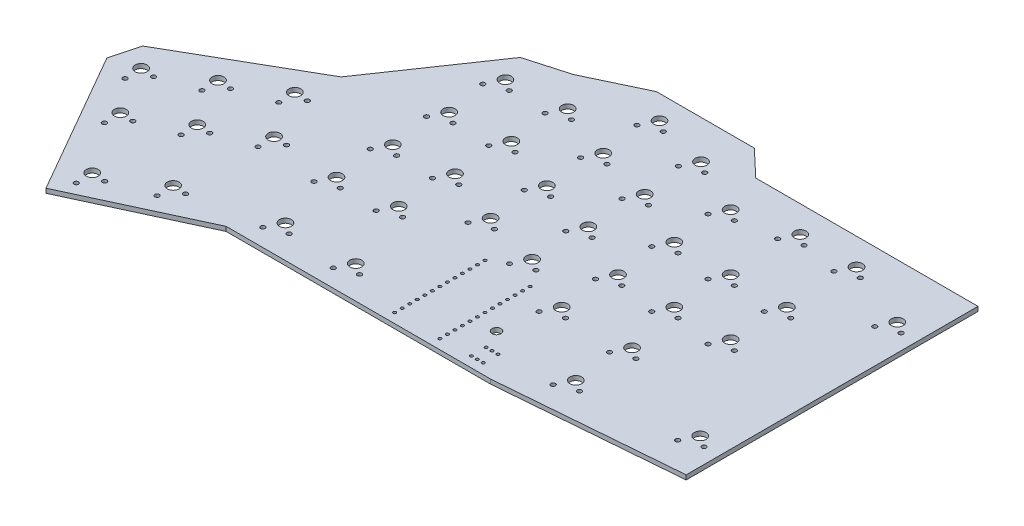
from build123d import *

# Parameters (mm, degrees)
BOSS_EXTRUDE1_DEPTH = 1.5
SKETCH3_R           = 2
CUT_EXTRUDE1_DEPTH  = 185.595537716
SKETCH4_R           = 0.75
CUT_EXTRUDE2_DEPTH  = 185.595537716
SKETCH5_R           = 0.5
SKETCH5_R_2         = 1.5
CUT_EXTRUDE3_DEPTH  = 185.595537716
SKETCH6_R           = 0.5
CUT_EXTRUDE4_DEPTH  = 185.595537716


with BuildPart() as part:
    # Sketch2 → Boss-Extrude1 (new body)
    with BuildSketch(Plane(origin=(0, 0, 0), x_dir=(1, 0, 0), z_dir=(0, 1, 0))):
        Polygon((71, 31), (38, 31), (19, 22), (5, 18), (-19.539258734, -17.929094976), (-62.018836039, -42.352147857), (-64.598339528, -51.909666455), (-36.810886505, -100.241022266), (4.75, -81), (94, -81), (155, -76), (155, 22.5), (80, 22.5), align=None)
    extrude(amount=-BOSS_EXTRUDE1_DEPTH)

    # Sketch3 → Cut-Extrude1 (cut, through all)
    with BuildSketch(Plane(origin=(0, 0, 0), x_dir=(1, 0, 0), z_dir=(0, 1, 0))):
        with Locations(Location((-55.799108885, -49.157659897, 0), (0, 0, 270))):
            Circle(SKETCH3_R)
        with Locations(Location((-39.327436053, -39.687496535, 0), (0, 0, 270))):
            Circle(SKETCH3_R)
        with Locations(Location((-22.85576322, -30.217333173, 0), (0, 0, 270))):
            Circle(SKETCH3_R)
        with Locations(Location((-46.328945523, -65.62933273, 0), (0, 0, 270))):
            Circle(SKETCH3_R)
        with Locations(Location((-29.857272691, -56.159169368, 0), (0, 0, 270))):
            Circle(SKETCH3_R)
        with Locations(Location((-13.385599858, -46.689006006, 0), (0, 0, 270))):
            Circle(SKETCH3_R)
        with Locations(Location((-33.494382019, -87.952784068, 0), (0, 0, 270))):
            Circle(SKETCH3_R)
        with Locations(Location((-16.155779038, -77.984191056, 0), (0, 0, 270))):
            Circle(SKETCH3_R)
        with Locations(Location((13.75, -70, 0), (0, 0, 270))):
            Circle(SKETCH3_R)
        with Locations(Location((37.5, -70, 0), (0, 0, 270))):
            Circle(SKETCH3_R)
        with Locations(Location((28, -46, 0), (0, 0, 270))):
            Circle(SKETCH3_R)
        with Locations(Location((9, -48, 0), (0, 0, 270))):
            Circle(SKETCH3_R)
        with Locations(Location((9, -29, 0), (0, 0, 270))):
            Circle(SKETCH3_R)
        with Locations(Location((28, -27, 0), (0, 0, 270))):
            Circle(SKETCH3_R)
        with Locations(Location((47, -34, 0), (0, 0, 270))):
            Circle(SKETCH3_R)
        with Locations(Location((66, -39, 0), (0, 0, 270))):
            Circle(SKETCH3_R)
        with Locations(Location((9, -10, 0), (0, 0, 270))):
            Circle(SKETCH3_R)
        with Locations(Location((9, 9, 0), (0, 0, 270))):
            Circle(SKETCH3_R)
        with Locations(Location((28, 11, 0), (0, 0, 270))):
            Circle(SKETCH3_R)
        with Locations(Location((47, 23, 0), (0, 0, 270))):
            Circle(SKETCH3_R)
        with Locations(Location((47, 4, 0), (0, 0, 270))):
            Circle(SKETCH3_R)
        with Locations(Location((28, -8, 0), (0, 0, 270))):
            Circle(SKETCH3_R)
        with Locations(Location((47, -15, 0), (0, 0, 270))):
            Circle(SKETCH3_R)
        with Locations(Location((66, 18, 0), (0, 0, 270))):
            Circle(SKETCH3_R)
        with Locations(Location((66, -1, 0), (0, 0, 270))):
            Circle(SKETCH3_R)
        with Locations(Location((66, -20, 0), (0, 0, 270))):
            Circle(SKETCH3_R)
        with Locations(Location((85, 9, 0), (0, 0, 270))):
            Circle(SKETCH3_R)
        with Locations(Location((104, 13.5, 0), (0, 0, 270))):
            Circle(SKETCH3_R)
        with Locations(Location((123, 13.5, 0), (0, 0, 270))):
            Circle(SKETCH3_R)
        with Locations(Location((146, 4.25, 0), (0, 0, 270))):
            Circle(SKETCH3_R)
        with Locations(Location((123, -10, 0), (0, 0, 270))):
            Circle(SKETCH3_R)
        with Locations(Location((104, -10, 0), (0, 0, 270))):
            Circle(SKETCH3_R)
        with Locations(Location((85, -10, 0), (0, 0, 270))):
            Circle(SKETCH3_R)
        with Locations(Location((85, -29, 0), (0, 0, 270))):
            Circle(SKETCH3_R)
        with Locations(Location((104, -29, 0), (0, 0, 270))):
            Circle(SKETCH3_R)
        with Locations(Location((123, -29, 0), (0, 0, 270))):
            Circle(SKETCH3_R)
        with Locations(Location((85, -48, 0), (0, 0, 270))):
            Circle(SKETCH3_R)
        with Locations(Location((108.75, -48, 0), (0, 0, 270))):
            Circle(SKETCH3_R)
        with Locations(Location((108.75, -67, 0), (0, 0, 270))):
            Circle(SKETCH3_R)
        with Locations(Location((146, -62.25, 0), (0, 0, 270))):
            Circle(SKETCH3_R)
    extrude(amount=-CUT_EXTRUDE1_DEPTH, mode=Mode.SUBTRACT)

    # Sketch4 → Cut-Extrude2 (cut, through all)
    with BuildSketch(Plane(origin=(0, 0, 0), x_dir=(1, 0, 0), z_dir=(0, 1, 0))):
        with Locations(Location((-55.540504123, -54.831382095, 0), (0, 0, 270))):
            Circle(SKETCH4_R)
        with Locations(Location((-51.234270651, -49.518148307, 0), (0, 0, 270))):
            Circle(SKETCH4_R)
        with Locations(Location((-39.068831291, -45.361218733, 0), (0, 0, 270))):
            Circle(SKETCH4_R)
        with Locations(Location((-34.762597818, -40.047984945, 0), (0, 0, 270))):
            Circle(SKETCH4_R)
        with Locations(Location((-22.597158458, -35.891055371, 0), (0, 0, 270))):
            Circle(SKETCH4_R)
        with Locations(Location((-18.290924986, -30.577821583, 0), (0, 0, 270))):
            Circle(SKETCH4_R)
        with Locations(Location((25.46, -51.08, 0), (0, 0, 270))):
            Circle(SKETCH4_R)
        with Locations(Location((149.81, 1.71, 0), (0, 0, 270))):
            Circle(SKETCH4_R)
        with Locations(Location((143.46, -0.83, 0), (0, 0, 270))):
            Circle(SKETCH4_R)
        with Locations(Location((120.46, 8.42, 0), (0, 0, 270))):
            Circle(SKETCH4_R)
        with Locations(Location((126.81, 10.96, 0), (0, 0, 270))):
            Circle(SKETCH4_R)
        with Locations(Location((126.81, -12.54, 0), (0, 0, 270))):
            Circle(SKETCH4_R)
        with Locations(Location((120.46, -15.08, 0), (0, 0, 270))):
            Circle(SKETCH4_R)
        with Locations(Location((143.46, -67.33, 0), (0, 0, 270))):
            Circle(SKETCH4_R)
        with Locations(Location((149.81, -64.79, 0), (0, 0, 270))):
            Circle(SKETCH4_R)
        with Locations(Location((126.81, -31.54, 0), (0, 0, 270))):
            Circle(SKETCH4_R)
        with Locations(Location((120.46, -34.08, 0), (0, 0, 270))):
            Circle(SKETCH4_R)
        with Locations(Location((107.81, -31.54, 0), (0, 0, 270))):
            Circle(SKETCH4_R)
        with Locations(Location((101.46, -34.08, 0), (0, 0, 270))):
            Circle(SKETCH4_R)
        with Locations(Location((106.21, -53.08, 0), (0, 0, 270))):
            Circle(SKETCH4_R)
        with Locations(Location((112.56, -50.54, 0), (0, 0, 270))):
            Circle(SKETCH4_R)
        with Locations(Location((112.56, -69.54, 0), (0, 0, 270))):
            Circle(SKETCH4_R)
        with Locations(Location((106.21, -72.08, 0), (0, 0, 270))):
            Circle(SKETCH4_R)
        with Locations(Location((107.81, 10.96, 0), (0, 0, 270))):
            Circle(SKETCH4_R)
        with Locations(Location((101.46, 8.42, 0), (0, 0, 270))):
            Circle(SKETCH4_R)
        with Locations(Location((107.81, -12.54, 0), (0, 0, 270))):
            Circle(SKETCH4_R)
        with Locations(Location((101.46, -15.08, 0), (0, 0, 270))):
            Circle(SKETCH4_R)
        with Locations(Location((88.81, -12.54, 0), (0, 0, 270))):
            Circle(SKETCH4_R)
        with Locations(Location((82.46, -15.08, 0), (0, 0, 270))):
            Circle(SKETCH4_R)
        with Locations(Location((82.46, 3.92, 0), (0, 0, 270))):
            Circle(SKETCH4_R)
        with Locations(Location((88.81, 6.46, 0), (0, 0, 270))):
            Circle(SKETCH4_R)
        with Locations(Location((88.81, -31.54, 0), (0, 0, 270))):
            Circle(SKETCH4_R)
        with Locations(Location((82.46, -34.08, 0), (0, 0, 270))):
            Circle(SKETCH4_R)
        with Locations(Location((69.81, 15.46, 0), (0, 0, 270))):
            Circle(SKETCH4_R)
        with Locations(Location((63.46, 12.92, 0), (0, 0, 270))):
            Circle(SKETCH4_R)
        with Locations(Location((69.81, -3.54, 0), (0, 0, 270))):
            Circle(SKETCH4_R)
        with Locations(Location((63.46, -6.08, 0), (0, 0, 270))):
            Circle(SKETCH4_R)
        with Locations(Location((69.81, -22.54, 0), (0, 0, 270))):
            Circle(SKETCH4_R)
        with Locations(Location((63.46, -25.08, 0), (0, 0, 270))):
            Circle(SKETCH4_R)
        with Locations(Location((63.46, -44.08, 0), (0, 0, 270))):
            Circle(SKETCH4_R)
        with Locations(Location((69.81, -41.54, 0), (0, 0, 270))):
            Circle(SKETCH4_R)
        with Locations(Location((88.81, -50.54, 0), (0, 0, 270))):
            Circle(SKETCH4_R)
        with Locations(Location((82.46, -53.08, 0), (0, 0, 270))):
            Circle(SKETCH4_R)
        with Locations(Location((41.31, -72.54, 0), (0, 0, 270))):
            Circle(SKETCH4_R)
        with Locations(Location((34.96, -75.08, 0), (0, 0, 270))):
            Circle(SKETCH4_R)
        with Locations(Location((31.81, -48.54, 0), (0, 0, 270))):
            Circle(SKETCH4_R)
        with Locations(Location((44.46, -39.08, 0), (0, 0, 270))):
            Circle(SKETCH4_R)
        with Locations(Location((50.81, -36.54, 0), (0, 0, 270))):
            Circle(SKETCH4_R)
        with Locations(Location((44.46, -20.08, 0), (0, 0, 270))):
            Circle(SKETCH4_R)
        with Locations(Location((50.81, -17.54, 0), (0, 0, 270))):
            Circle(SKETCH4_R)
        with Locations(Location((31.81, -29.54, 0), (0, 0, 270))):
            Circle(SKETCH4_R)
        with Locations(Location((25.46, -32.08, 0), (0, 0, 270))):
            Circle(SKETCH4_R)
        with Locations(Location((25.46, -13.08, 0), (0, 0, 270))):
            Circle(SKETCH4_R)
        with Locations(Location((31.81, -10.54, 0), (0, 0, 270))):
            Circle(SKETCH4_R)
        with Locations(Location((12.81, -12.54, 0), (0, 0, 270))):
            Circle(SKETCH4_R)
        with Locations(Location((6.46, -15.08, 0), (0, 0, 270))):
            Circle(SKETCH4_R)
        with Locations(Location((6.46, 3.92, 0), (0, 0, 270))):
            Circle(SKETCH4_R)
        with Locations(Location((12.81, 6.46, 0), (0, 0, 270))):
            Circle(SKETCH4_R)
        with Locations(Location((25.46, 5.92, 0), (0, 0, 270))):
            Circle(SKETCH4_R)
        with Locations(Location((31.81, 8.46, 0), (0, 0, 270))):
            Circle(SKETCH4_R)
        with Locations(Location((44.46, 17.92, 0), (0, 0, 270))):
            Circle(SKETCH4_R)
        with Locations(Location((50.81, 20.46, 0), (0, 0, 270))):
            Circle(SKETCH4_R)
        with Locations(Location((50.81, 1.46, 0), (0, 0, 270))):
            Circle(SKETCH4_R)
        with Locations(Location((44.46, -1.08, 0), (0, 0, 270))):
            Circle(SKETCH4_R)
        with Locations(Location((12.81, -31.54, 0), (0, 0, 270))):
            Circle(SKETCH4_R)
        with Locations(Location((6.46, -34.08, 0), (0, 0, 270))):
            Circle(SKETCH4_R)
        with Locations(Location((12.81, -50.54, 0), (0, 0, 270))):
            Circle(SKETCH4_R)
        with Locations(Location((6.46, -53.08, 0), (0, 0, 270))):
            Circle(SKETCH4_R)
        with Locations(Location((17.56, -72.54, 0), (0, 0, 270))):
            Circle(SKETCH4_R)
        with Locations(Location((11.21, -75.08, 0), (0, 0, 270))):
            Circle(SKETCH4_R)
        with Locations(Location((-8.820761624, -47.049494416, 0), (0, 0, 270))):
            Circle(SKETCH4_R)
        with Locations(Location((-13.126995096, -52.362728203, 0), (0, 0, 270))):
            Circle(SKETCH4_R)
        with Locations(Location((-25.292434456, -56.519657778, 0), (0, 0, 270))):
            Circle(SKETCH4_R)
        with Locations(Location((-29.598667929, -61.832891565, 0), (0, 0, 270))):
            Circle(SKETCH4_R)
        with Locations(Location((-41.764107289, -65.98982114, 0), (0, 0, 270))):
            Circle(SKETCH4_R)
        with Locations(Location((-46.070340761, -71.303054927, 0), (0, 0, 270))):
            Circle(SKETCH4_R)
        with Locations(Location((-28.929543785, -88.313272478, 0), (0, 0, 270))):
            Circle(SKETCH4_R)
        with Locations(Location((-33.235777257, -93.626506266, 0), (0, 0, 270))):
            Circle(SKETCH4_R)
        with Locations(Location((-15.897174276, -83.657913253, 0), (0, 0, 270))):
            Circle(SKETCH4_R)
        with Locations(Location((-11.590940803, -78.344679466, 0), (0, 0, 270))):
            Circle(SKETCH4_R)
    extrude(amount=-CUT_EXTRUDE2_DEPTH, mode=Mode.SUBTRACT)

    # Sketch5 → Cut-Extrude3 (cut, through all)
    with BuildSketch(Plane(origin=(0, 0, 0), x_dir=(1, 0, 0), z_dir=(0, 1, 0))):
        with Locations(Location((58.38, -77.75, 0), (0, 0, 270))):
            Circle(SKETCH5_R)
        with Locations(Location((58.38, -75.21, 0), (0, 0, 270))):
            Circle(SKETCH5_R)
        with Locations(Location((58.38, -72.67, 0), (0, 0, 270))):
            Circle(SKETCH5_R)
        with Locations(Location((58.38, -70.13, 0), (0, 0, 270))):
            Circle(SKETCH5_R)
        with Locations(Location((58.38, -67.59, 0), (0, 0, 270))):
            Circle(SKETCH5_R)
        with Locations(Location((58.38, -65.05, 0), (0, 0, 270))):
            Circle(SKETCH5_R)
        with Locations(Location((58.38, -62.51, 0), (0, 0, 270))):
            Circle(SKETCH5_R)
        with Locations(Location((58.38, -59.97, 0), (0, 0, 270))):
            Circle(SKETCH5_R)
        with Locations(Location((58.38, -57.43, 0), (0, 0, 270))):
            Circle(SKETCH5_R)
        with Locations(Location((58.38, -54.89, 0), (0, 0, 270))):
            Circle(SKETCH5_R)
        with Locations(Location((58.38, -52.35, 0), (0, 0, 270))):
            Circle(SKETCH5_R)
        with Locations(Location((58.38, -49.81, 0), (0, 0, 270))):
            Circle(SKETCH5_R)
        with Locations(Location((58.38, -47.27, 0), (0, 0, 270))):
            Circle(SKETCH5_R)
        with Locations(Location((73.62, -47.27, 0), (0, 0, 90))):
            Circle(SKETCH5_R)
        with Locations(Location((73.62, -49.81, 0), (0, 0, 90))):
            Circle(SKETCH5_R)
        with Locations(Location((73.62, -52.35, 0), (0, 0, 90))):
            Circle(SKETCH5_R)
        with Locations(Location((73.62, -54.89, 0), (0, 0, 90))):
            Circle(SKETCH5_R)
        with Locations(Location((73.62, -57.43, 0), (0, 0, 90))):
            Circle(SKETCH5_R)
        with Locations(Location((73.62, -59.97, 0), (0, 0, 90))):
            Circle(SKETCH5_R)
        with Locations(Location((73.62, -62.51, 0), (0, 0, 90))):
            Circle(SKETCH5_R)
        with Locations(Location((73.62, -65.05, 0), (0, 0, 90))):
            Circle(SKETCH5_R)
        with Locations(Location((73.62, -67.59, 0), (0, 0, 90))):
            Circle(SKETCH5_R)
        with Locations(Location((73.62, -70.13, 0), (0, 0, 90))):
            Circle(SKETCH5_R)
        with Locations(Location((73.62, -72.67, 0), (0, 0, 90))):
            Circle(SKETCH5_R)
        with Locations(Location((73.62, -75.21, 0), (0, 0, 90))):
            Circle(SKETCH5_R)
        with Locations(Location((73.62, -77.75, 0), (0, 0, 90))):
            Circle(SKETCH5_R)
        with Locations(Location((81, -66, 0), (0, 0, 270))):
            Circle(SKETCH5_R_2)
    extrude(amount=-CUT_EXTRUDE3_DEPTH, mode=Mode.SUBTRACT)

    # Sketch6 → Cut-Extrude4 (cut, through all)
    with BuildSketch(Plane(origin=(0, 0, 0), x_dir=(1, 0, 0), z_dir=(0, 1, 0))):
        with Locations(Location((84, -77.5, 0), (0, 0, 270))):
            Circle(SKETCH6_R)
        with Locations(Location((88, -77.5, 0), (0, 0, 270))):
            Circle(SKETCH6_R)
        with Locations(Location((86, -77.5, 0), (0, 0, 270))):
            Circle(SKETCH6_R)
        with Locations(Location((88, -72.5, 0), (0, 0, 270))):
            Circle(SKETCH6_R)
        with Locations(Location((84, -72.5, 0), (0, 0, 270))):
            Circle(SKETCH6_R)
        with Locations(Location((86, -72.5, 0), (0, 0, 270))):
            Circle(SKETCH6_R)
    extrude(amount=-CUT_EXTRUDE4_DEPTH, mode=Mode.SUBTRACT)


solid = part.part
